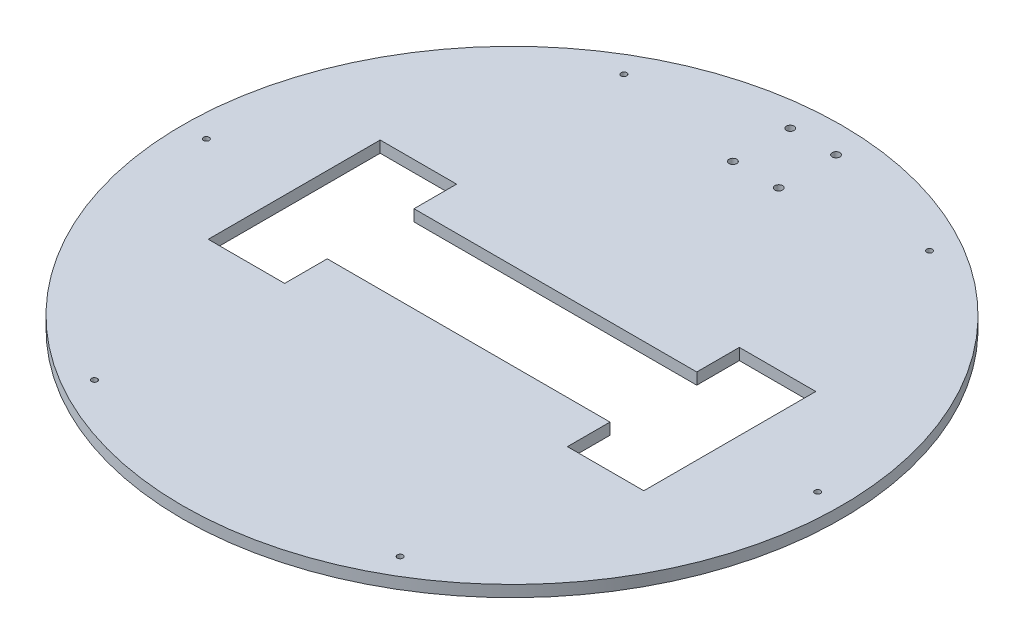
from build123d import *

# Parameters (mm, degrees)
SKETCH_1_R      = 2.013000515
SKETCH_1_R_2    = 1.5
EXTRUDE_2_DEPTH = 6


with BuildPart() as part:
    # 草图1 → 凸台-拉伸2 (new body)
    # profile 1 of 2: a face of its own
    with BuildSketch(Plane(origin=(0, 0, 0), x_dir=(1, 0, 0), z_dir=(0, 1, 0))):
        with BuildLine():
            ThreePointArc((158.5, 0), (160, 1.5), (161.5, 0))
            Line((161.5, 0), (172.5, 0))
            ThreePointArc((172.5, 0), (0, 172.5), (-172.5, 0))
            Line((-172.5, 0), (-161.5, 0))
            ThreePointArc((-161.5, 0), (-160, 1.5), (-158.5, 0))
            Line((-158.5, 0), (-114, 0))
            Line((-114, 0), (-114, 45))
            Line((-114, 45), (-74, 45))
            Line((-74, 45), (-74, 22.705919103))
            Line((-74, 22.705919103), (74, 22.705919103))
            Line((74, 22.705919103), (74, 45))
            Line((74, 45), (114, 45))
            Line((114, 45), (114, 0))
            Line((114, 0), (158.5, 0))
        make_face()
        with Locations(Location((-12, 127.620399327, 0), (0, 0, 270))):
            Circle(SKETCH_1_R, mode=Mode.SUBTRACT)
        with Locations(Location((-80, 138.564064606, 0), (0, 0, 270))):
            Circle(SKETCH_1_R_2, mode=Mode.SUBTRACT)
        with Locations(Location((-12, 157.620399327, 0), (0, 0, 270))):
            Circle(SKETCH_1_R, mode=Mode.SUBTRACT)
        with Locations(Location((12, 127.620399327, 0), (0, 0, 270))):
            Circle(SKETCH_1_R, mode=Mode.SUBTRACT)
        with Locations(Location((12, 157.620399327, 0), (0, 0, 270))):
            Circle(SKETCH_1_R, mode=Mode.SUBTRACT)
        with Locations(Location((80, 138.564064606, 0), (0, 0, 270))):
            Circle(SKETCH_1_R_2, mode=Mode.SUBTRACT)
    # profile 2 of 2: a face of its own
    with BuildSketch(Plane(origin=(0, 0, 0), x_dir=(1, 0, 0), z_dir=(0, 1, 0))):
        with BuildLine():
            Line((172.5, 0), (161.5, 0))
            ThreePointArc((161.5, 0), (160, -1.5), (158.5, 0))
            Line((158.5, 0), (114, 0))
            Line((114, 0), (114, -45))
            Line((114, -45), (74, -45))
            Line((74, -45), (74, -22.705919103))
            Line((74, -22.705919103), (-74, -22.705919103))
            Line((-74, -22.705919103), (-74, -45))
            Line((-74, -45), (-114, -45))
            Line((-114, -45), (-114, 0))
            Line((-114, 0), (-158.5, 0))
            ThreePointArc((-158.5, 0), (-160, -1.5), (-161.5, 0))
            Line((-161.5, 0), (-172.5, 0))
            ThreePointArc((-172.5, 0), (0, -172.5), (172.5, 0))
        make_face()
        with Locations(Location((-80, -138.564064606, 0), (0, 0, 270))):
            Circle(SKETCH_1_R_2, mode=Mode.SUBTRACT)
        with Locations(Location((80, -138.564064606, 0), (0, 0, 270))):
            Circle(SKETCH_1_R_2, mode=Mode.SUBTRACT)
    extrude(amount=-EXTRUDE_2_DEPTH)


solid = part.part
